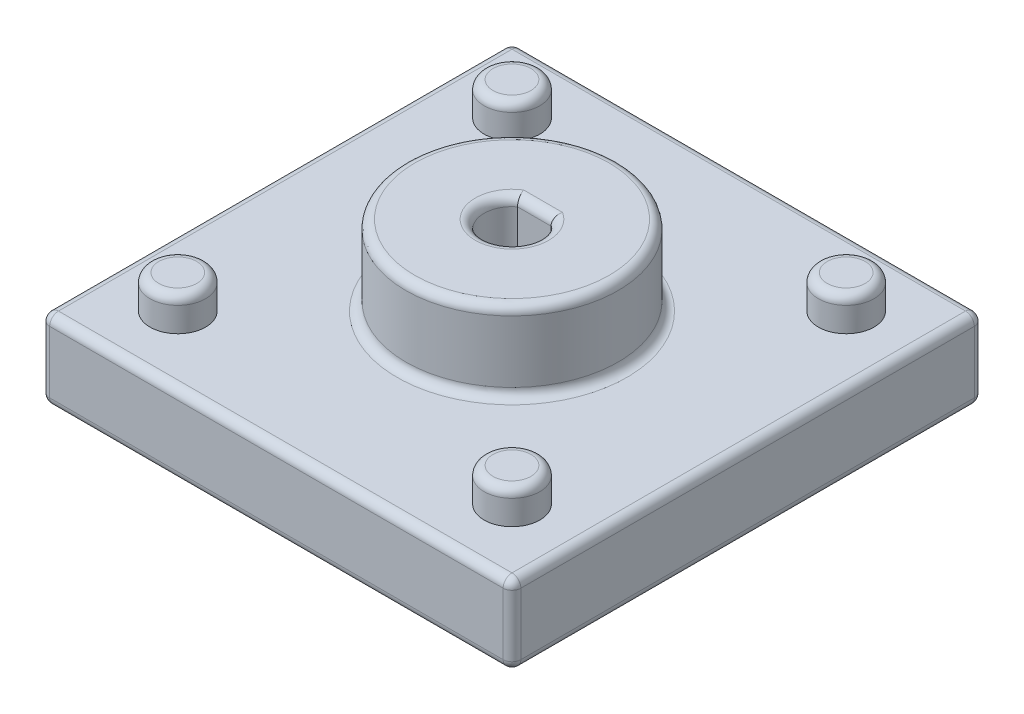
from build123d import *

# Parameters (mm, degrees)
SKETCH1_R           = 9.525
BOSS_EXTRUDE1_DEPTH = 14.2875
SKETCH2_W           = 42.3
SKETCH2_H           = 42.3
SKETCH2_R           = 9.525
BOSS_EXTRUDE2_DEPTH = 7.14375
SKETCH3_R           = 2.499995
BOSS_EXTRUDE3_DEPTH = 3
FILLET1_R           = 0.79375


with BuildPart() as part:
    # Sketch1 → Boss-Extrude1 (new body)
    with BuildSketch(Plane(origin=(0, 0, 0), x_dir=(1, 0, 0), z_dir=(0, 1, 0))):
        with Locations(Location((0, 0, 0), (0, 0, 270))):
            Circle(SKETCH1_R)
        with BuildLine():
            Line((-1.5, 2), (1.5, 2))
            ThreePointArc((1.5, 2), (0, -2.5), (-1.5, 2))
        make_face(mode=Mode.SUBTRACT)
    extrude(amount=BOSS_EXTRUDE1_DEPTH)

    # Sketch2 → Boss-Extrude2 (add)
    with BuildSketch(Plane(origin=(0, 0, 0), x_dir=(1, 0, 0), z_dir=(0, 1, 0))):
        Rectangle(SKETCH2_W, SKETCH2_H)
        with Locations(Location((0, 0, 0), (0, 0, 90))):
            Circle(SKETCH2_R, mode=Mode.SUBTRACT)
    extrude(amount=BOSS_EXTRUDE2_DEPTH)

    # Sketch3 → Boss-Extrude3 (add)
    with BuildSketch(Plane(origin=(0, 7.14375, 0), x_dir=(1, 0, 0), z_dir=(0, 1, 0))):
        with Locations(Location((-15, 15, 0), (0, 0, 90))):
            Circle(SKETCH3_R)
        with Locations(Location((15, 15, 0), (0, 0, 90))):
            Circle(SKETCH3_R)
        with Locations(Location((15, -15, 0), (0, 0, 90))):
            Circle(SKETCH3_R)
        with Locations(Location((-15, -15, 0), (0, 0, 90))):
            Circle(SKETCH3_R)
    extrude(amount=BOSS_EXTRUDE3_DEPTH)

    # Fillet1
    fillet1_edges = [part.edges().sort_by_distance(p)[0] for p in [
        (0, 7.14375, -9.525),
        (21.15, 7.14375, 0),
        (0, 7.14375, -21.15),
        (-21.15, 7.14375, 0),
        (0, 7.14375, 21.15),
        (21.15, 0, 0),
        (21.15, 3.571875, 21.15),
        (0, 0, -21.15),
        (21.15, 3.571875, -21.15),
        (-21.15, 0, 0),
        (-21.15, 3.571875, -21.15),
        (0, 0, 21.15),
        (-21.15, 3.571875, 21.15),
        (-15, 10.14375, 17.499995),
        (15, 10.14375, 17.499995),
        (15, 10.14375, -12.500005),
        (-15, 10.14375, -12.500005),
        (0, 14.2875, -9.525),
        (0, 0, 2.5),
        (0, 0, -2),
        (0, 14.2875, 2.5),
        (0, 14.2875, -2),
    ]]
    fillet(fillet1_edges, radius=FILLET1_R)


solid = part.part
